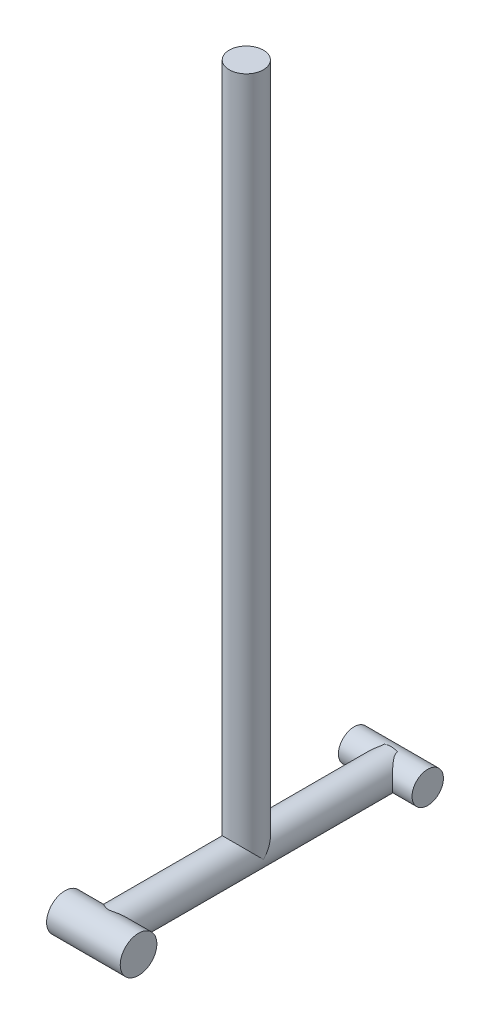
from build123d import *

# Parameters (mm, degrees)
SKETCH1_W   = 101.6
SKETCH1_H   = 4072.636
SKETCH2_W   = 1722.12
SKETCH2_H   = 101.6
SKETCH3_W   = 438.393418328
SKETCH3_H   = 93.490817115
SKETCH3_4_W = 438.393418328
SKETCH3_4_H = 109.072619968


with BuildPart() as part:
    # Sketch1 → Revolve3 (revolve)
    with BuildSketch(Plane.XY):
        with Locations((-50.8, 2036.318)):
            Rectangle(SKETCH1_W, SKETCH1_H)
    revolve(axis=Axis((0, 0, 0), (0, 1, 0)))

    # Sketch2 → Revolve4 (revolve)
    with BuildSketch(Plane(origin=(0, 0, 0), x_dir=(0, 0, -1), z_dir=(1, 0, 0))):
        with Locations((0, 50.8)):
            Rectangle(SKETCH2_W, SKETCH2_H)
    revolve(axis=Axis((0, 0, 861.06), (0, 0, -1)))

    # Sketch3 → Revolve7 (revolve)
    with BuildSketch(Plane(origin=(0, 0, 0), x_dir=(1, 0, 0), z_dir=(0, 1, 0))):
        with Locations((0, 907.805408558)):
            Rectangle(SKETCH3_W, SKETCH3_H)
    revolve(axis=Axis((-219.196709164, 0, -861.06), (1, 0, 0)))

    # Sketch3<4> → Revolve9 (revolve)
    with BuildSketch(Plane(origin=(0, 0, 0), x_dir=(1, 0, 0), z_dir=(0, 1, 0))):
        with Locations((0, -915.596309984)):
            Rectangle(SKETCH3_4_W, SKETCH3_4_H)
    revolve(axis=Axis((-219.196709164, 0, 861.06), (1, 0, 0)))


solid = part.part
